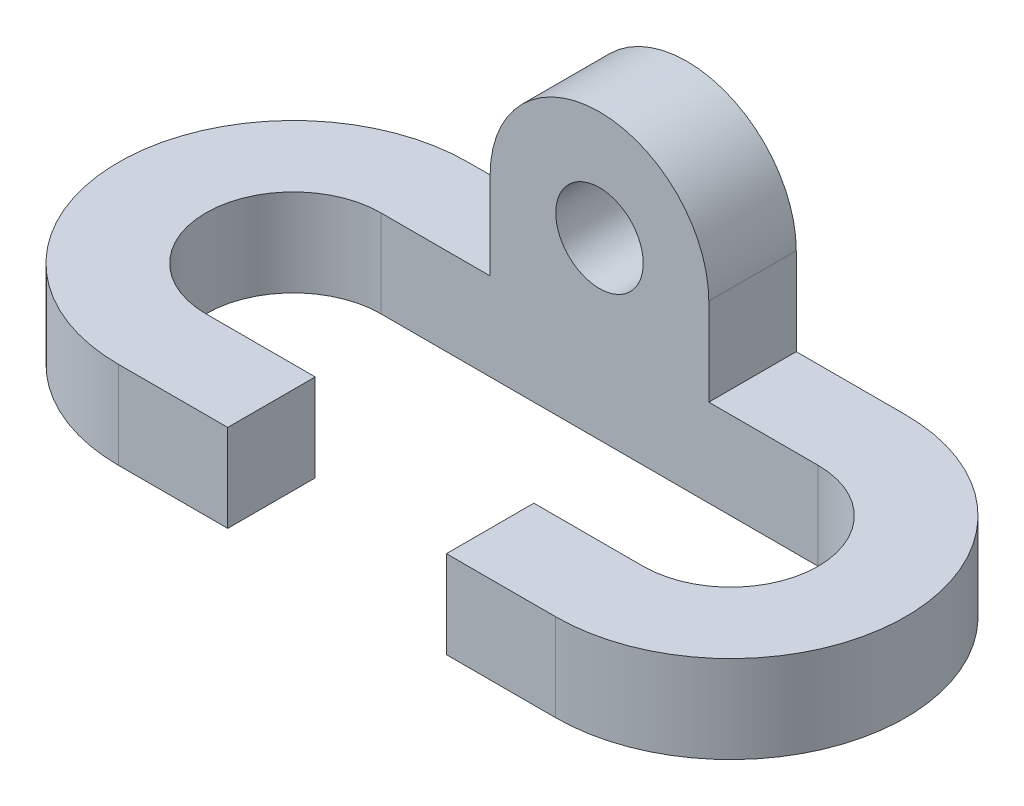
from build123d import *

# Parameters (mm, degrees)
BOSS_EXTRUDE2_DEPTH        = 12.7
F_1_1_DIAMETER_HOLE1_D     = 25.4
SKETCH6_W                  = 63.5
SKETCH6_H                  = 25.4
CUT_EXTRUDE1_DEPTH         = 12.7
SKETCH7_W                  = 31.75
SKETCH7_H                  = 12.7
CUT_EXTRUDE2_DEPTH         = 12.7
SKETCH8_W                  = 31.75
SKETCH8_H                  = 12.7
BOSS_EXTRUDE3_DEPTH        = 28.575
F_1_2_0_5_DIAMETER_HOLE1_D = 12.7
CUT_EXTRUDE4_DEPTH         = 12.7


with BuildPart() as part:
    # Sketch3 → Boss-Extrude2 (new body)
    with BuildSketch(Plane(origin=(0, 0, 0), x_dir=(1, 0, 0), z_dir=(0, 1, 0))):
        with BuildLine():
            Line((0, 0), (-63.5, 0))
            ThreePointArc((-63.5, 0), (-88.9, 25.4), (-63.5, 50.8))
            Line((-63.5, 50.8), (0, 50.8))
            ThreePointArc((0, 50.8), (25.4, 25.4), (0, 0))
        make_face()
    extrude(amount=BOSS_EXTRUDE2_DEPTH)

    # 1 (1) Diameter Hole1 (through all)
    with Locations(Plane(origin=(0, 12.7, 0), x_dir=(1, 0, 0), z_dir=(0, 1, 0))):
        with Locations((-63.5, 25.4), (0, 25.4)):
            Hole(F_1_1_DIAMETER_HOLE1_D / 2)

    # Sketch6 → Cut-Extrude1 (cut)
    with BuildSketch(Plane(origin=(0, 12.7, 0), x_dir=(1, 0, 0), z_dir=(0, 1, 0))):
        with Locations((-31.75, 25.4)):
            Rectangle(SKETCH6_W, SKETCH6_H)
    extrude(amount=-CUT_EXTRUDE1_DEPTH, mode=Mode.SUBTRACT)

    # Sketch7 → Cut-Extrude2 (cut)
    with BuildSketch(Plane.XY):
        with Locations((-31.75, 6.35)):
            Rectangle(SKETCH7_W, SKETCH7_H)
    extrude(amount=-CUT_EXTRUDE2_DEPTH, mode=Mode.SUBTRACT)

    # Sketch8 → Boss-Extrude3 (add)
    with BuildSketch(Plane(origin=(0, 12.7, 0), x_dir=(1, 0, 0), z_dir=(0, 1, 0))):
        with Locations((-31.75, 44.45)):
            Rectangle(SKETCH8_W, SKETCH8_H)
    extrude(amount=BOSS_EXTRUDE3_DEPTH)

    # 1/2 (0.5) Diameter Hole1 (through all)
    with Locations(Plane.XY.offset(-38.1)):
        with Locations((-31.75, 25.4)):
            Hole(F_1_2_0_5_DIAMETER_HOLE1_D / 2)

    # Sketch12 → Cut-Extrude4 (cut)
    with BuildSketch(Plane.XY.offset(-38.1)):
        with BuildLine():
            Line((-31.75, 41.275), (-47.625, 41.275))
            Line((-47.625, 41.275), (-47.625, 25.4))
            ThreePointArc((-47.625, 25.4), (-42.975320151, 36.625320151), (-31.75, 41.275))
        make_face()
        with BuildLine():
            Line((-15.875, 41.275), (-31.75, 41.275))
            ThreePointArc((-31.75, 41.275), (-20.524679849, 36.625320151), (-15.875, 25.4))
            Line((-15.875, 25.4), (-15.875, 41.275))
        make_face()
    extrude(amount=-CUT_EXTRUDE4_DEPTH, mode=Mode.SUBTRACT)


solid = part.part
